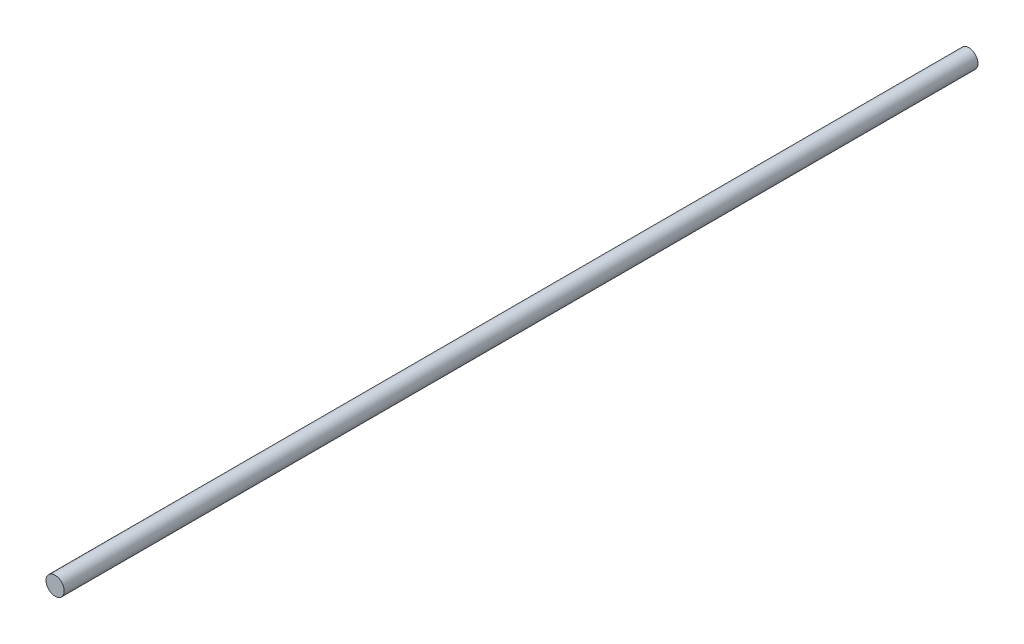
from build123d import *

# Parameters (mm, degrees)
ESBO_O1_R                = 1.5
RESSALTO_EXTRUS_O1_DEPTH = 150


with BuildPart() as part:
    # Esboço1 → Ressalto-extrusão1 (new body)
    with BuildSketch(Plane.XY):
        Circle(ESBO_O1_R)
    extrude(amount=RESSALTO_EXTRUS_O1_DEPTH)


solid = part.part
